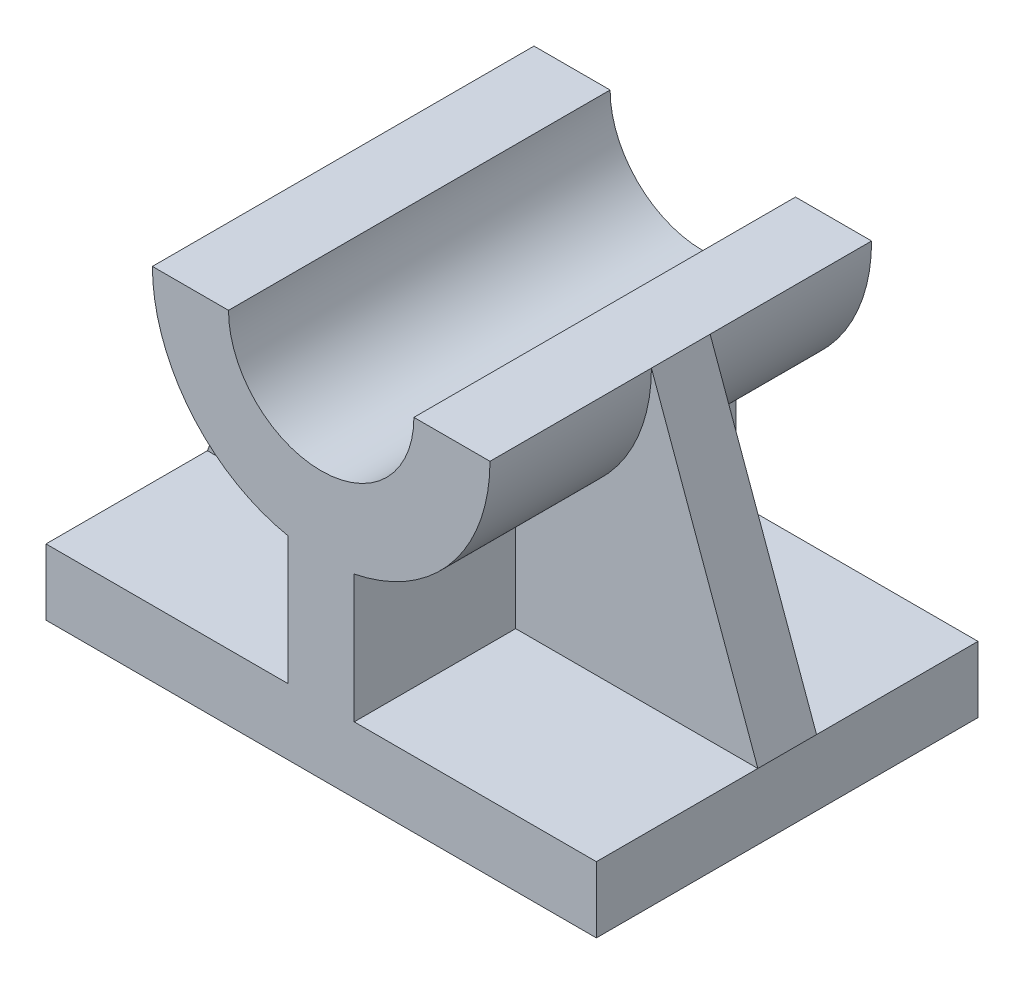
from build123d import *

# Parameters (mm, degrees)
BOSS_EXTRUDE5_DEPTH = 26000
RIB7_REACH          = 63739.744
SKETCH14_WALL_W     = 170024.52063883
SKETCH14_WALL_H     = 8000


with BuildPart() as part:
    # Sketch11 → Boss-Extrude5 (new, symmetric)
    with BuildSketch(Plane.XY):
        with BuildLine():
            Line((23000, 44500), (12632.371641507, 44500))
            ThreePointArc((12632.371641507, 44500), (0, 31867.628358493), (-12632.371641507, 44500))
            Line((-12632.371641507, 44500), (-23000, 44500))
            ThreePointArc((-23000, 44500), (-17783.419243779, 29914.047854185), (-4500, 21944.51286272))
            Line((-4500, 21944.51286272), (-4500, 4500))
            Line((-4500, 4500), (-37500, 4500))
            Line((-37500, 4500), (-37500, -4500))
            Line((-37500, -4500), (37500, -4500))
            Line((37500, -4500), (37500, 4500))
            Line((37500, 4500), (4500, 4500))
            Line((4500, 4500), (4500, 21944.51286272))
            ThreePointArc((4500, 21944.51286272), (17783.419243779, 29914.047854185), (23000, 44500))
        make_face()
    extrude(amount=BOSS_EXTRUDE5_DEPTH, both=True)

    # Sketch14 wall → Rib7 (add, up to next)
    with BuildSketch(Plane(origin=(30250, 24500, 0), x_dir=(0.340799323621, -0.940136065162, 0), z_dir=(0.940136065162, 0.340799323621, 0)), mode=Mode.PRIVATE) as rib7_sk1:
        Rectangle(SKETCH14_WALL_W, SKETCH14_WALL_H)
    rib7_tool1 = extrude(rib7_sk1.sketch, amount=-RIB7_REACH, mode=Mode.PRIVATE) - part.part
    rib7 = rib7_tool1.solids().sort_by_distance((30250, 24500, 0))[0]
    add(rib7)

    # Mirror1: Rib7 across plane
    add(rib7.mirror(Plane(origin=(0, 0, 0), x_dir=(0, 0, 1), z_dir=(1, 0, 0))))


solid = part.part
